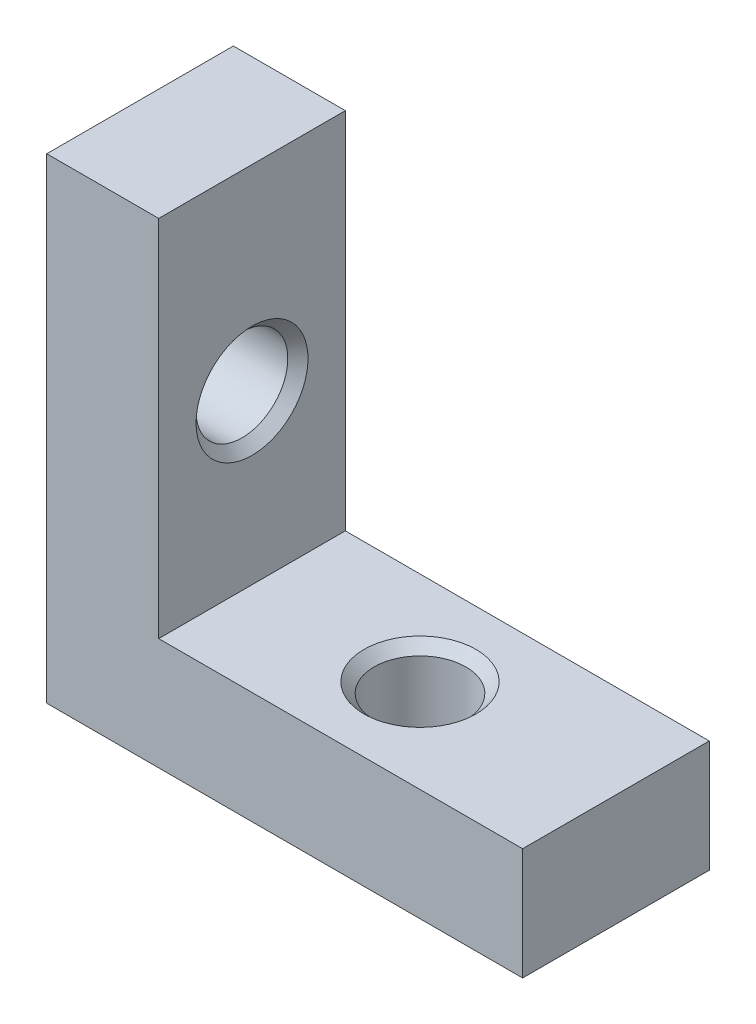
from build123d import *

# Parameters (mm, degrees)
ESQUISSE1_W             = 45
ESQUISSE1_H             = 45
BOSS_EXTRU_1_DEPTH      = 10
ESQUISSE2_W             = 39
ESQUISSE2_H             = 39
ENL_V_MAT_EXTRU_1_DEPTH = 65.420493634
PER_AGE1_D              = 4.9175
PER_AGE2_D              = 4.9175
PER_AGE2_DEPTH          = 45
PER_AGE3_D              = 4.9175
CHANFREIN1_SIZE         = 0.54125
ESQUISSE9_W             = 19.5
ESQUISSE9_H             = 10
ENL_V_MAT_EXTRU_2_DEPTH = 10
ESQUISSE10_W            = 10
ESQUISSE10_H            = 19.5
ENL_V_MAT_EXTRU_3_DEPTH = 10


with BuildPart() as part:
    # Esquisse1 → Boss.-Extru.1 (new body)
    with BuildSketch(Plane(origin=(0, 0, -5), x_dir=(-1, 0, 0), z_dir=(0, 0, -1))):
        with Locations((-22.5, 22.5)):
            Rectangle(ESQUISSE1_W, ESQUISSE1_H)
    extrude(amount=-BOSS_EXTRU_1_DEPTH)

    # Esquisse2 → Enlèv. mat.-Extru.1 (cut, through all)
    with BuildSketch(Plane.XY.offset(5)):
        with Locations((25.5, 25.5)):
            Rectangle(ESQUISSE2_W, ESQUISSE2_H)
    extrude(amount=-ENL_V_MAT_EXTRU_1_DEPTH, mode=Mode.SUBTRACT)

    # Perçage1 (through all)
    with Locations(Plane(origin=(0, 6, 0), x_dir=(1, 0, 0), z_dir=(0, 1, 0))):
        with Locations((35, 0), (15, 0)):
            Hole(PER_AGE1_D / 2)

    # Perçage2
    with Locations(Plane.ZY):
        with Locations((0, 15)):
            Hole(PER_AGE2_D / 2, depth=PER_AGE2_DEPTH)

    # Perçage3 (through all)
    with Locations(Plane(origin=(6, 0, 0), x_dir=(0, 0, -1), z_dir=(1, 0, 0))):
        with Locations((0, 35)):
            Hole(PER_AGE3_D / 2)

    # Chanfrein1
    chanfrein1_edges = [part.edges().sort_by_distance(p)[0] for p in [
        (17.45875, 6, 0),
        (17.45875, 0, 0),
        (37.45875, 6, 0),
        (37.45875, 0, 0),
        (6, 15, 2.45875),
        (0, 15, 2.45875),
        (6, 35, -2.45875),
        (0, 35, -2.45875),
    ]]
    chamfer(chanfrein1_edges, length=CHANFREIN1_SIZE)

    # Esquisse9 → Enlèv. mat.-Extru.2 (cut)
    with BuildSketch(Plane(origin=(0, 6, 0), x_dir=(1, 0, 0), z_dir=(0, 1, 0))):
        with Locations((35.25, 0)):
            Rectangle(ESQUISSE9_W, ESQUISSE9_H)
    extrude(amount=-ENL_V_MAT_EXTRU_2_DEPTH, mode=Mode.SUBTRACT)

    # Esquisse10 → Enlèv. mat.-Extru.3 (cut)
    with BuildSketch(Plane(origin=(6, 0, 0), x_dir=(0, 0, -1), z_dir=(1, 0, 0))):
        with Locations((0, 35.25)):
            Rectangle(ESQUISSE10_W, ESQUISSE10_H)
    extrude(amount=-ENL_V_MAT_EXTRU_3_DEPTH, mode=Mode.SUBTRACT)


solid = part.part
